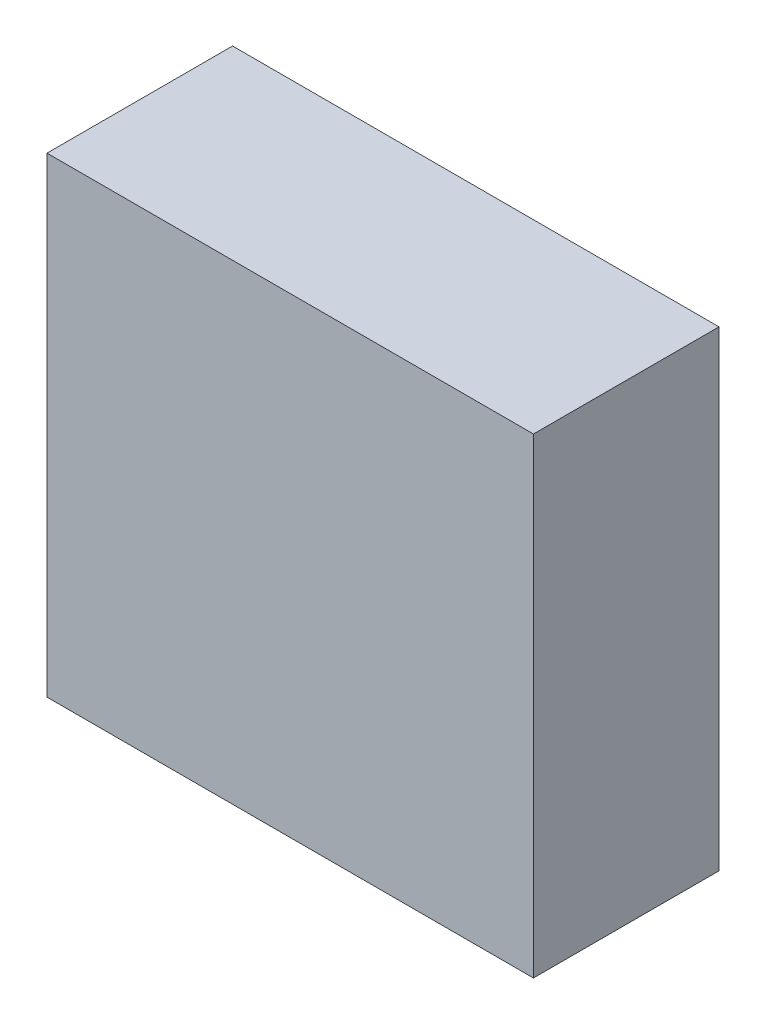
from build123d import *

# Parameters (mm, degrees)
ESQUISSE1_W        = 26.214106704
ESQUISSE1_H        = 25.389255499
BOSS_EXTRU_1_DEPTH = 10


with BuildPart() as part:
    # Esquisse1 → Boss.-Extru.1 (new body)
    with BuildSketch(Plane.XY):
        with Locations((-13.107053352, 12.69462775)):
            Rectangle(ESQUISSE1_W, ESQUISSE1_H)
    extrude(amount=BOSS_EXTRU_1_DEPTH)


solid = part.part
